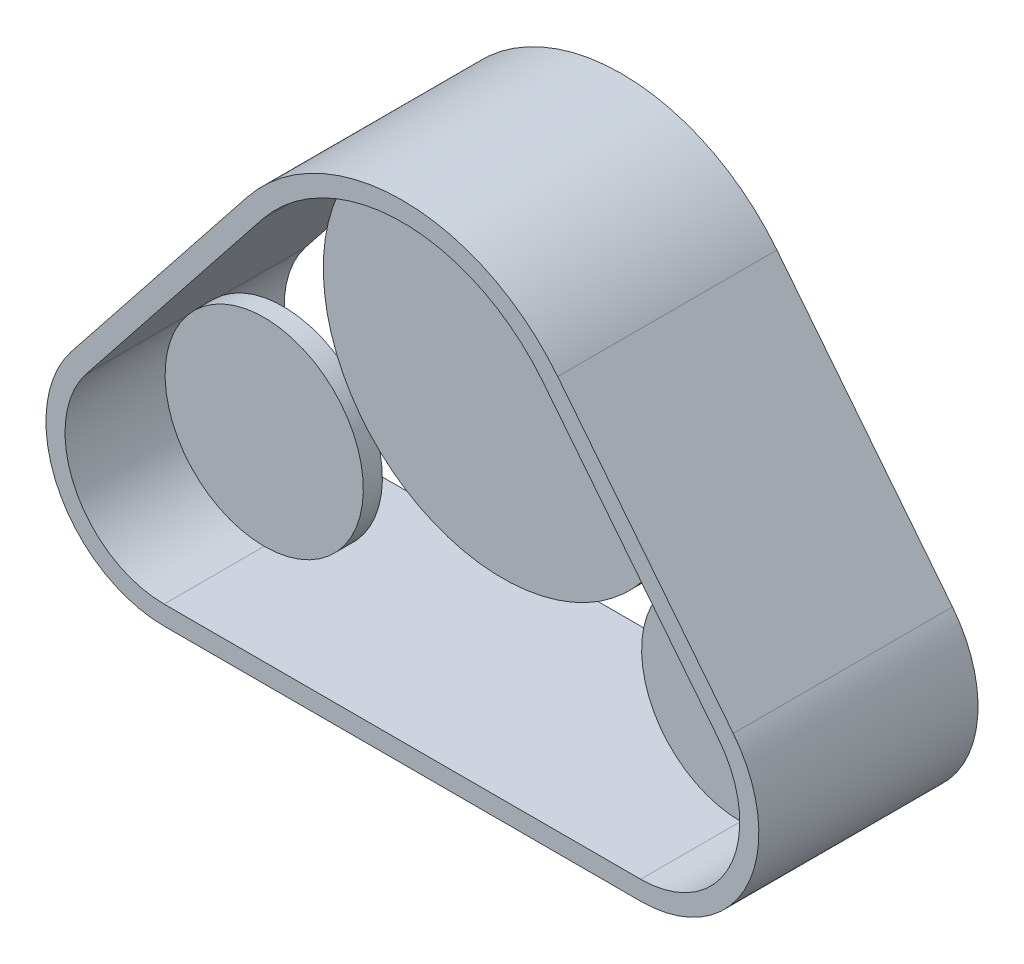
from build123d import *

# Parameters (mm, degrees)
SCHIZZO1_R                     = 52
ESTRUSIONE_ESTRUSIONE1_DEPTH   = 10
ESTRUSIONE_ESTRUSIONE1_2_DEPTH = 10
SCHIZZO1_R_2                   = 94
ESTRUSIONE_ESTRUSIONE1_3_DEPTH = 10
ESTRUSIONE_SOTTILE1_DEPTH      = 52.5
ESTRUSIONE_SOTTILE1_DEPTH_BACK = 62.5


with BuildPart() as part:
    # Schizzo1 → Estrusione-Estrusione1 (new body)
    with BuildSketch(Plane.XY):
        with Locations((-125, 0)):
            Circle(SCHIZZO1_R)
    extrude(amount=ESTRUSIONE_ESTRUSIONE1_DEPTH)



with BuildPart() as body_2:
    # Schizzo1 → Estrusione-Estrusione1 2 (new body)
    with BuildSketch(Plane.XY):
        with Locations((125, 0)):
            Circle(SCHIZZO1_R)
    extrude(amount=ESTRUSIONE_ESTRUSIONE1_2_DEPTH)


with BuildPart() as body_3:
    # Schizzo1 → Estrusione-Estrusione1 3 (new body)
    with BuildSketch(Plane.XY):
        with Locations((0, 90)):
            Circle(SCHIZZO1_R_2)
    extrude(amount=ESTRUSIONE_ESTRUSIONE1_3_DEPTH)


with BuildPart() as part_1:
    add(part.part)

    add(body_2.part)  # Estrusione-Sottile1 merges body 2

    add(body_3.part)  # Estrusione-Sottile1 merges body 3
    # Schizzo2 → Estrusione-Sottile1 (add, two sides: drawn at the far end of the back side and taken through both)
    with BuildSketch(Plane.XY.offset(10).offset(-ESTRUSIONE_SOTTILE1_DEPTH_BACK)):
        with BuildLine():
            Line((81.478662228, 154.631475316), (173.573817867, 38.530302592))
            ThreePointArc((173.573817867, 38.530302592), (180.825078418, -26.973331638), (125, -62))
            Line((125, -62), (-125, -62))
            ThreePointArc((-125, -62), (-180.825078418, -26.973331638), (-173.573817867, 38.530302592))
            Line((-173.573817867, 38.530302592), (-81.478662228, 154.631475316))
            ThreePointArc((-81.478662228, 154.631475316), (0, 194), (81.478662228, 154.631475316))
        make_face()
        with BuildLine():
            Line((73.644175475, 148.416910382), (165.739331114, 32.315737658))
            ThreePointArc((165.739331114, 32.315737658), (171.821033512, -22.622794277), (125, -52))
            Line((125, -52), (-125, -52))
            ThreePointArc((-125, -52), (-171.821033512, -22.622794277), (-165.739331114, 32.315737658))
            Line((-165.739331114, 32.315737658), (-73.644175475, 148.416910382))
            ThreePointArc((-73.644175475, 148.416910382), (0, 184), (73.644175475, 148.416910382))
        make_face(mode=Mode.SUBTRACT)
    extrude(amount=ESTRUSIONE_SOTTILE1_DEPTH + ESTRUSIONE_SOTTILE1_DEPTH_BACK)


solid = part_1.part
